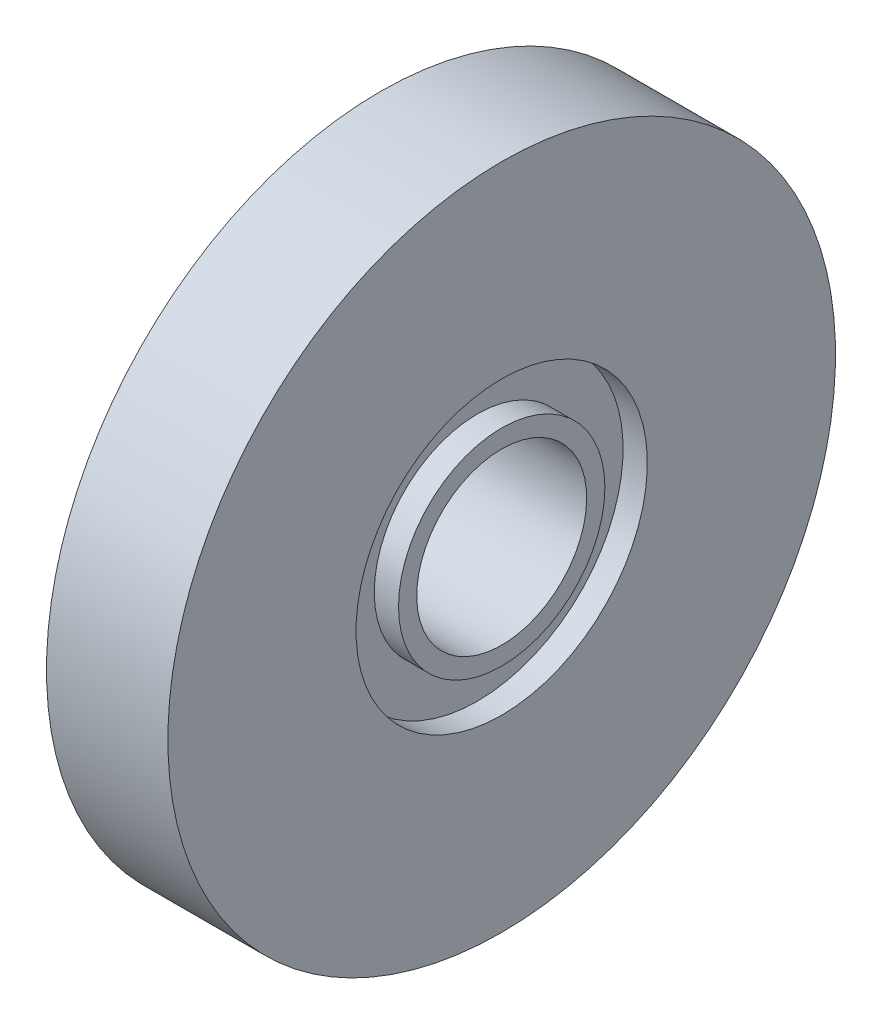
from build123d import *


with BuildPart() as part:
    # Sketch1 → Revolve1 (revolve)
    with BuildSketch(Plane.XY):
        Polygon((-5, 7), (5, 7), (5, 8.5), (3, 8.5), (3, 12), (5, 12), (5, 27.5), (-5, 27.5), (-5, 12), (-3, 12), (-3, 8.5), (-5, 8.5), align=None)
    revolve(axis=Axis((0, 0, 0), (-1, 0, 0)))


solid = part.part
